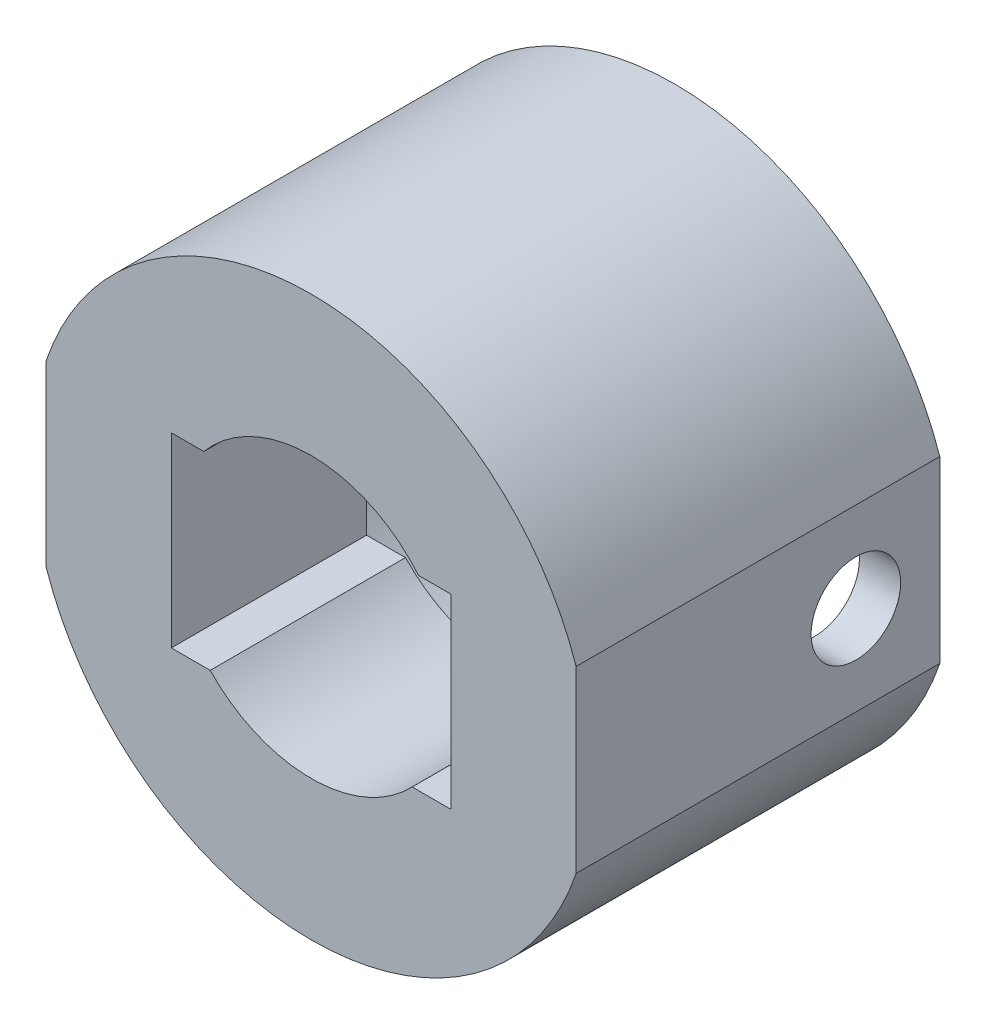
from build123d import *

# Parameters (mm, degrees)
EXTRUDE_2_DEPTH      = 10
SKETCH_5_R           = 1.6
CUT_EXTRUDE_1_DEPTH  = 27
SKETCH_8_R           = 8
EXTRUDE_4_DEPTH      = 10
SKETCH_8_3_R         = 8
CUT_EXTRUDE_4_DEPTH  = 4.62
SKETCH_10_R          = 5
CUT_EXTRUDE_6_DEPTH  = 33.62
CUT_EXTRUDE_7_DEPTH  = 33.62
EXTRUDE_5_DEPTH      = 3
SKETCH_13_R          = 8
CUT_EXTRUDE_8_DEPTH  = 1.4
CUT_EXTRUDE_10_DEPTH = 6.02


with BuildPart() as part:
    # 草图4 → 凸台-拉伸2 (new body)
    with BuildSketch(Plane.XY):
        with BuildLine():
            Line((-9.472780877, 3.204125849), (-7.330319061, 3.204125849))
            ThreePointArc((-7.330319061, 3.204125849), (0, 8), (7.330319061, 3.204125849))
            Line((7.330319061, 3.204125849), (9.472780877, 3.204125849))
            ThreePointArc((9.472780877, 3.204125849), (0, 10), (-9.472780877, 3.204125849))
        make_face()
        with BuildLine():
            Line((9.472780877, 3.204125849), (7.330319061, 3.204125849))
            ThreePointArc((7.330319061, 3.204125849), (7.83079027, 1.636680712), (8, 0))
            ThreePointArc((8, 0), (7.83079027, -1.636680712), (7.330319061, -3.204125849))
            Line((7.330319061, -3.204125849), (9.472780877, -3.204125849))
            Line((9.472780877, -3.204125849), (9.472780877, 3.204125849))
        make_face()
        with BuildLine():
            ThreePointArc((7.330319061, -3.204125849), (0, -8), (-7.330319061, -3.204125849))
            Line((-7.330319061, -3.204125849), (-9.472780877, -3.204125849))
            ThreePointArc((-9.472780877, -3.204125849), (0, -10), (9.472780877, -3.204125849))
            Line((9.472780877, -3.204125849), (7.330319061, -3.204125849))
        make_face()
        with BuildLine():
            ThreePointArc((-7.330319061, -3.204125849), (-8, 0), (-7.330319061, 3.204125849))
            Line((-7.330319061, 3.204125849), (-9.472780877, 3.204125849))
            Line((-9.472780877, 3.204125849), (-9.472780877, -3.204125849))
            Line((-9.472780877, -3.204125849), (-7.330319061, -3.204125849))
        make_face()
    extrude(amount=EXTRUDE_2_DEPTH)

    # 草图5 → 切除-拉伸1 (cut)
    with BuildSketch(Plane.ZY.offset(9.472780877)):
        with Locations((3, 0)):
            Circle(SKETCH_5_R)
    extrude(amount=-CUT_EXTRUDE_1_DEPTH, mode=Mode.SUBTRACT)

    # 草图8 → 凸台-拉伸4 (add)
    with BuildSketch(Plane(origin=(0, 0, 0), x_dir=(-1, 0, 0), z_dir=(0, 0, -1))):
        Circle(SKETCH_8_R)
    extrude(amount=-EXTRUDE_4_DEPTH)

    # 草图8<3> → 切除-拉伸4 (cut)
    with BuildSketch(Plane(origin=(0, 0, 0), x_dir=(-1, 0, 0), z_dir=(0, 0, -1))):
        Circle(SKETCH_8_3_R)
    extrude(amount=-CUT_EXTRUDE_4_DEPTH, mode=Mode.SUBTRACT)

    # 草图10 → 切除-拉伸6 (cut)
    with BuildSketch(Plane.XY.offset(10)):
        Circle(SKETCH_10_R)
    extrude(amount=-CUT_EXTRUDE_6_DEPTH, mode=Mode.SUBTRACT)

    # 草图11 → 切除-拉伸7 (cut)
    with BuildSketch(Plane.XY.offset(10)):
        with BuildLine():
            ThreePointArc((5, 0), (4.639856446, -1.863258479), (3.611307136, -3.458100746))
            Line((3.611307136, -3.458100746), (5, -3.458100746))
            Line((5, -3.458100746), (5, 0))
        make_face()
        with BuildLine():
            Line((5, 3.204125849), (3.838434257, 3.204125849))
            ThreePointArc((3.838434257, 3.204125849), (4.700647364, 1.704087544), (5, 0))
            Line((5, 0), (5, 3.204125849))
        make_face()
        with BuildLine():
            Line((-3.838434257, 3.204125849), (-5, 3.204125849))
            Line((-5, 3.204125849), (-5, 0))
            ThreePointArc((-5, 0), (-4.700647364, 1.704087544), (-3.838434257, 3.204125849))
        make_face()
        with BuildLine():
            ThreePointArc((-3.611307136, -3.458100746), (-4.639856446, -1.863258479), (-5, 0))
            Line((-5, 0), (-5, -3.458100746))
            Line((-5, -3.458100746), (-3.611307136, -3.458100746))
        make_face()
    extrude(amount=-CUT_EXTRUDE_7_DEPTH, mode=Mode.SUBTRACT)

    # 草图14 → 凸台-拉伸5 (add)
    with BuildSketch(Plane.XY.offset(10)):
        with BuildLine():
            Line((-9.472780877, 3.204125849), (-9.472780877, -3.204125849))
            ThreePointArc((-9.472780877, -3.204125849), (0, -10), (9.472780877, -3.204125849))
            Line((9.472780877, -3.204125849), (9.472780877, 3.204125849))
            ThreePointArc((9.472780877, 3.204125849), (0, 10), (-9.472780877, 3.204125849))
        make_face()
        with BuildLine():
            ThreePointArc((-3.838434257, 3.204125849), (0, 5), (3.838434257, 3.204125849))
            Line((3.838434257, 3.204125849), (5, 3.204125849))
            Line((5, 3.204125849), (5, -3.458100746))
            Line((5, -3.458100746), (3.611307136, -3.458100746))
            ThreePointArc((3.611307136, -3.458100746), (0, -5), (-3.611307136, -3.458100746))
            Line((-3.611307136, -3.458100746), (-5, -3.458100746))
            Line((-5, -3.458100746), (-5, 3.204125849))
            Line((-5, 3.204125849), (-3.838434257, 3.204125849))
        make_face(mode=Mode.SUBTRACT)
    extrude(amount=EXTRUDE_5_DEPTH)

    # 草图13 → 切除-拉伸8 (cut)
    with BuildSketch(Plane(origin=(0, 0, 4.62), x_dir=(-1, 0, 0), z_dir=(0, 0, -1))):
        Circle(SKETCH_13_R)
        with BuildLine():
            Line((-5, -3.458100746), (-3.611307136, -3.458100746))
            ThreePointArc((-3.611307136, -3.458100746), (0, -5), (3.611307136, -3.458100746))
            Line((3.611307136, -3.458100746), (5, -3.458100746))
            Line((5, -3.458100746), (5, 3.204125849))
            Line((5, 3.204125849), (3.838434257, 3.204125849))
            ThreePointArc((3.838434257, 3.204125849), (0, 5), (-3.838434257, 3.204125849))
            Line((-3.838434257, 3.204125849), (-5, 3.204125849))
            Line((-5, 3.204125849), (-5, -3.458100746))
        make_face(mode=Mode.SUBTRACT)
    extrude(amount=-CUT_EXTRUDE_8_DEPTH, mode=Mode.SUBTRACT)

    # 草图15 → 切除-拉伸10 (cut)
    with BuildSketch(Plane(origin=(0, 0, 0), x_dir=(-1, 0, 0), z_dir=(0, 0, -1))):
        Polygon((-8, 3.204125849), (-8, -3.204125849), (8, -3.204125849), (8, 3.204125849), (-7.888349605, 3.204125849), align=None)
    extrude(amount=-CUT_EXTRUDE_10_DEPTH, mode=Mode.SUBTRACT)


solid = part.part
